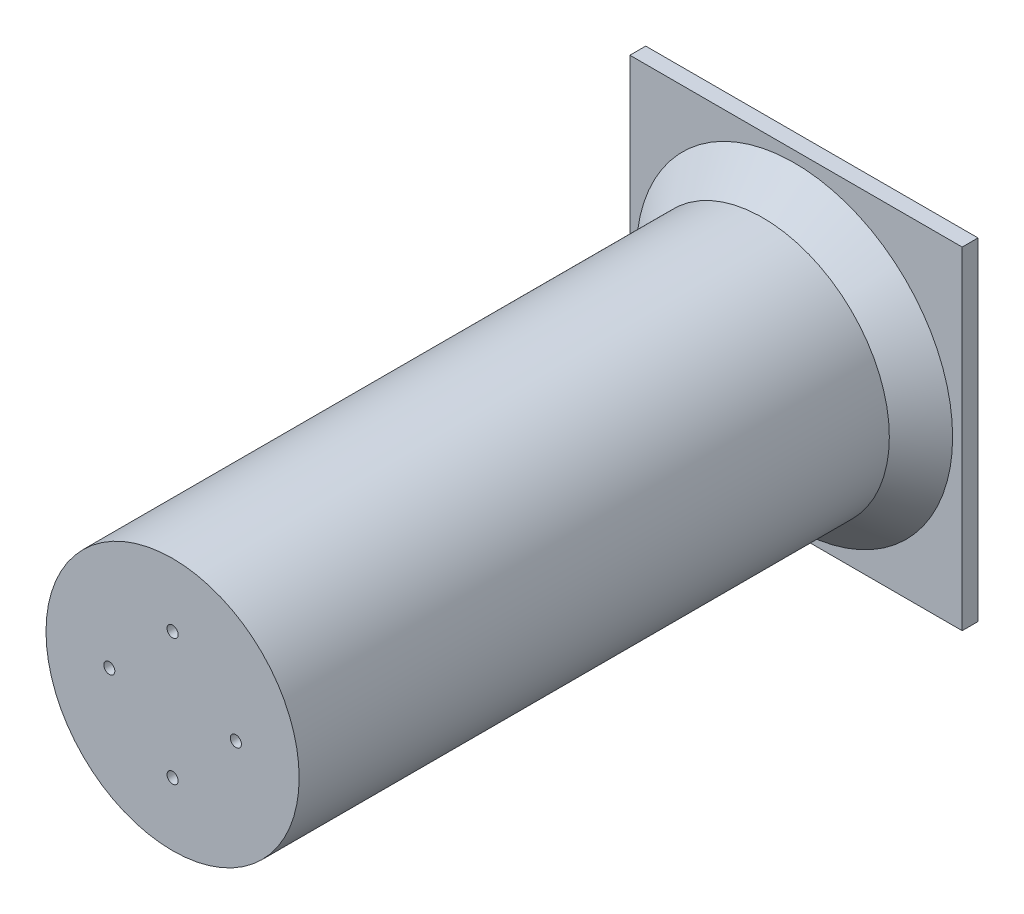
from build123d import *

# Parameters (mm, degrees)
CROQUIS1_W                  = 248.76
CROQUIS1_H                  = 195
SALIENTE_EXTRUIR1_DEPTH     = 5
CROQUIS2_W                  = 48
CROQUIS2_H                  = 30
CROQUIS2_W_2                = 30
CORTAR_EXTRUIR1_DEPTH       = 2
CROQUIS3_R                  = 2.375
CORTAR_EXTRUIR2_DEPTH       = 10
CROQUIS4_R                  = 40
SALIENTE_EXTRUIR2_DEPTH     = 196.5
CROQUIS5_R                  = 12.5
CORTAR_EXTRUIR3_DEPTH       = 10
CROQUIS12_W                 = 12
CROQUIS12_H                 = 30
SALIENTE_EXTRUIR3_DEPTH     = 4
REDONDEO1_R                 = 10
REDONDEO2_R                 = 10
REDONDEO3_R                 = 10
CORTAR_EXTRUIR5_DEPTH       = 255.266033949
CORTAR_EXTRUIR5_DEPTH_BACK  = 255.266033949
CROQUIS13_R                 = 1.625
CORTAR_EXTRUIR7_DEPTH       = 2
CROQUIS16_R                 = 1.75
CORTAR_EXTRUIR9_DEPTH       = 20
CORTAR_EXTRUIR17_DEPTH      = 307.465597013
CORTAR_EXTRUIR17_DEPTH_BACK = 307.465597013
CROQUIS21_W                 = 105
CROQUIS21_H                 = 105
SALIENTE_EXTRUIR4_DEPTH     = 5
CHAFL_N1_SIZE               = 10


with BuildPart() as part:
    # Croquis1 → Saliente-Extruir1 (new body)
    with BuildSketch(Plane.XY):
        with Locations((7.088293187, 0.26268)):
            Rectangle(CROQUIS1_W, CROQUIS1_H)
    extrude(amount=SALIENTE_EXTRUIR1_DEPTH)

    # Croquis2 → Cortar-Extruir1 (cut)
    with BuildSketch(Plane.XY.offset(5)):
        with Locations((-93.291706813, -82.23732)):
            Rectangle(CROQUIS2_W, CROQUIS2_H)
        with Locations((116.468293187, 82.76268)):
            Rectangle(CROQUIS2_W_2, CROQUIS2_H)
        with Locations((116.468293187, -82.23732)):
            Rectangle(CROQUIS2_W_2, CROQUIS2_H)
        with Locations((-93.291706813, 82.76268)):
            Rectangle(CROQUIS2_W, CROQUIS2_H)
    extrude(amount=-CORTAR_EXTRUIR1_DEPTH, mode=Mode.SUBTRACT)

    # Croquis3 → Cortar-Extruir2 (cut)
    with BuildSketch(Plane.XY.offset(5)):
        with Locations((-93.291706813, 83.76268)):
            Circle(CROQUIS3_R)
        with Locations((-93.291706813, -83.23732)):
            Circle(CROQUIS3_R)
        with Locations((116.468293187, 83.76268)):
            Circle(CROQUIS3_R)
        with Locations((116.468293187, -83.23732)):
            Circle(CROQUIS3_R)
    extrude(amount=-CORTAR_EXTRUIR2_DEPTH, mode=Mode.SUBTRACT)

    # Croquis4 → Saliente-Extruir2 (add)
    with BuildSketch(Plane(origin=(0, 0, 0), x_dir=(-1, 0, 0), z_dir=(0, 0, -1))):
        with Locations(Location((55.101706813, 0.26268, 0), (0, 0, 180))):
            Circle(CROQUIS4_R)
    extrude(amount=SALIENTE_EXTRUIR2_DEPTH)

    # Croquis5 → Cortar-Extruir3 (cut)
    with BuildSketch(Plane(origin=(0, 0, 0), x_dir=(-1, 0, 0), z_dir=(0, 0, -1))):
        with Locations((-76.968293187, 0.26268)):
            Circle(CROQUIS5_R)
    extrude(amount=-CORTAR_EXTRUIR3_DEPTH, mode=Mode.SUBTRACT)

    # Croquis12 → Saliente-Extruir3 (add, symmetric)
    with BuildSketch(Plane(origin=(7.088293187, 0, 0), x_dir=(0, 0, -1), z_dir=(1, 0, 0))):
        with Locations((6, 82.76268)):
            Rectangle(CROQUIS12_W, CROQUIS12_H)
        with Locations((6, -82.23732)):
            Rectangle(CROQUIS12_W, CROQUIS12_H)
    extrude(amount=SALIENTE_EXTRUIR3_DEPTH, both=True)

    # Redondeo1
    redondeo1_edges = [part.edges().sort_by_distance(p)[0] for p in [
        (7.088293187, 67.76268, 0),
        (7.088293187, -67.23732, 0),
    ]]
    fillet(redondeo1_edges, radius=REDONDEO1_R)

    # Redondeo2
    redondeo2_edges = [part.edges().sort_by_distance(p)[0] for p in [
        (7.088293187, 67.76268, -12),
        (7.088293187, -67.23732, -12),
    ]]
    fillet(redondeo2_edges, radius=REDONDEO2_R)

    # Redondeo3
    redondeo3_edges = [part.edges().sort_by_distance(p)[0] for p in [
        (7.088293187, 97.76268, -12),
        (7.088293187, -97.23732, -12),
    ]]
    fillet(redondeo3_edges, radius=REDONDEO3_R)

    # Croquis13 → Cortar-Extruir5 (cut, two sides: drawn at the far end of the back side and taken through both)
    with BuildSketch(Plane(origin=(11.088293187, 0, 0), x_dir=(0, 0, -1), z_dir=(1, 0, 0)).offset(-CORTAR_EXTRUIR5_DEPTH_BACK)):
        with Locations(Location((6, 87.76268, 0), (0, 0, 90))):
            Circle(CROQUIS13_R)
        with Locations(Location((6, 77.76268, 0), (0, 0, 90))):
            Circle(CROQUIS13_R)
        with Locations(Location((6, -77.23732, 0), (0, 0, 90))):
            Circle(CROQUIS13_R)
        with Locations(Location((6, -87.23732, 0), (0, 0, 90))):
            Circle(CROQUIS13_R)
    extrude(amount=CORTAR_EXTRUIR5_DEPTH + CORTAR_EXTRUIR5_DEPTH_BACK, mode=Mode.SUBTRACT)

    # Croquis15 → Cortar-Extruir7 (cut)
    with BuildSketch(Plane.XY.offset(5)):
        Polygon((111.468293187, 67.76268), (131.468293187, 67.76268), (131.468293187, -67.23732), (111.468293187, -67.23732), (111.468293187, -59.48732), (125.218293187, -59.48732), (125.218293187, 60.01268), (111.468293187, 60.01268), align=None)
    extrude(amount=-CORTAR_EXTRUIR7_DEPTH, mode=Mode.SUBTRACT)

    # Croquis16 → Cortar-Extruir9 (cut)
    with BuildSketch(Plane.XY.offset(5)):
        with Locations((-55.101706813, 20.26268)):
            Circle(CROQUIS16_R)
        with Locations((-35.101706813, 0.26268)):
            Circle(CROQUIS16_R)
        with Locations((-55.101706813, -19.73732)):
            Circle(CROQUIS16_R)
        with Locations((-75.101706813, 0.26268)):
            Circle(CROQUIS16_R)
    extrude(amount=-CORTAR_EXTRUIR9_DEPTH, mode=Mode.SUBTRACT)

    # Croquis20 → Cortar-Extruir17 (cut, two sides: drawn at the far end of the back side and taken through both)
    with BuildSketch(Plane.XZ.offset(97.23732).offset(-CORTAR_EXTRUIR17_DEPTH_BACK)):
        Polygon((-117.291706813, 10.531534682), (-117.291706813, 0), (3.088293187, 0), (3.088293187, -12), (11.088293187, -12), (11.088293187, 0), (131.468293187, 0), (131.468293187, 10.531534682), align=None)
    extrude(amount=CORTAR_EXTRUIR17_DEPTH + CORTAR_EXTRUIR17_DEPTH_BACK, mode=Mode.SUBTRACT)

    # Croquis21 → Saliente-Extruir4 (add)
    with BuildSketch(Plane(origin=(0, 0, -196.5), x_dir=(-1, 0, 0), z_dir=(0, 0, -1))):
        with Locations((54.583486428, 1.233156347)):
            Rectangle(CROQUIS21_W, CROQUIS21_H)
    extrude(amount=SALIENTE_EXTRUIR4_DEPTH)

    # Chaflán1
    chafl_n1_edges = [part.edges().sort_by_distance(p)[0] for p in [
        (-95.101706813, 0.26268, -196.5),
    ]]
    chamfer(chafl_n1_edges, length=CHAFL_N1_SIZE)


solid = part.part
